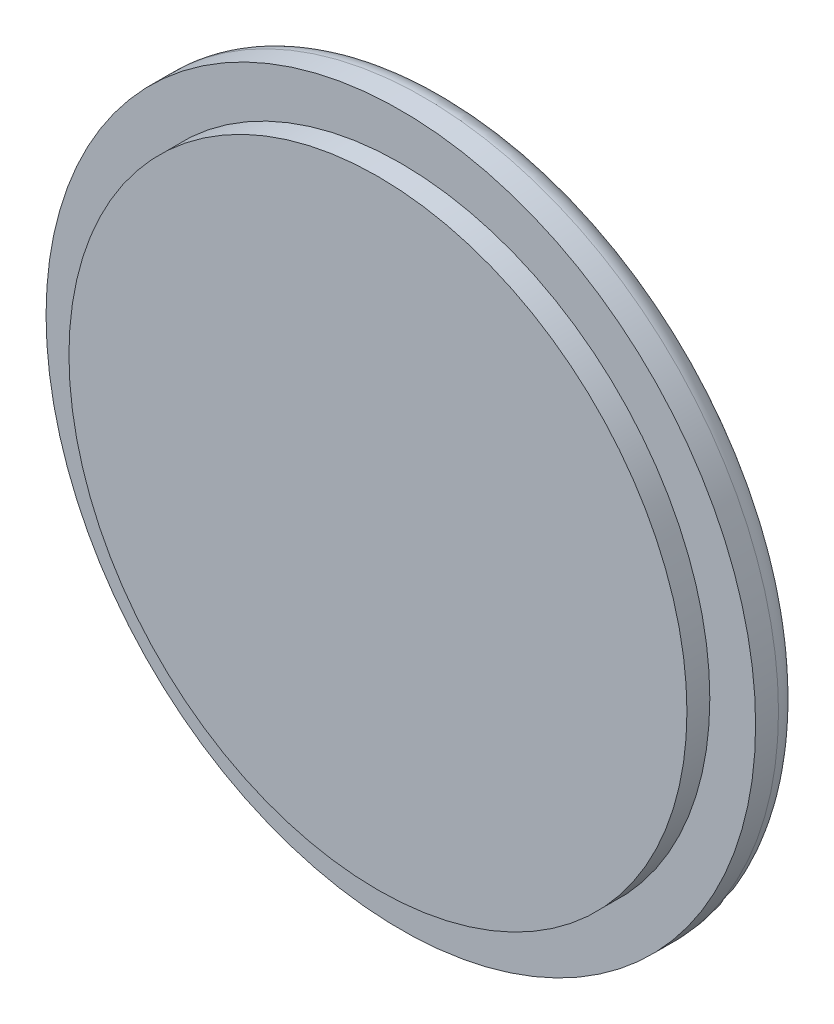
from build123d import *


with BuildPart() as part:
    # Sketch1 → Revolve1 (revolve)
    with BuildSketch(Plane(origin=(0, 0, 0), x_dir=(0, 0, -1), z_dir=(1, 0, 0)), mode=Mode.PRIVATE) as revolve1_sk:
        with BuildLine():
            Line((0, 0), (0, 135))
            Line((0, 135), (10, 135))
            Line((10, 135), (10, 155))
            Line((10, 155), (20, 155))
            ThreePointArc((20, 155), (27.071067812, 152.071067812), (30, 145))
            Line((30, 145), (30, 0))
            Line((30, 0), (0, 0))
        make_face()
    revolve(revolve1_sk.sketch.rotate(Axis((0, 0, -30), (0, 0, 1)), 90), axis=Axis((0, 0, -30), (0, 0, 1)))


solid = part.part
